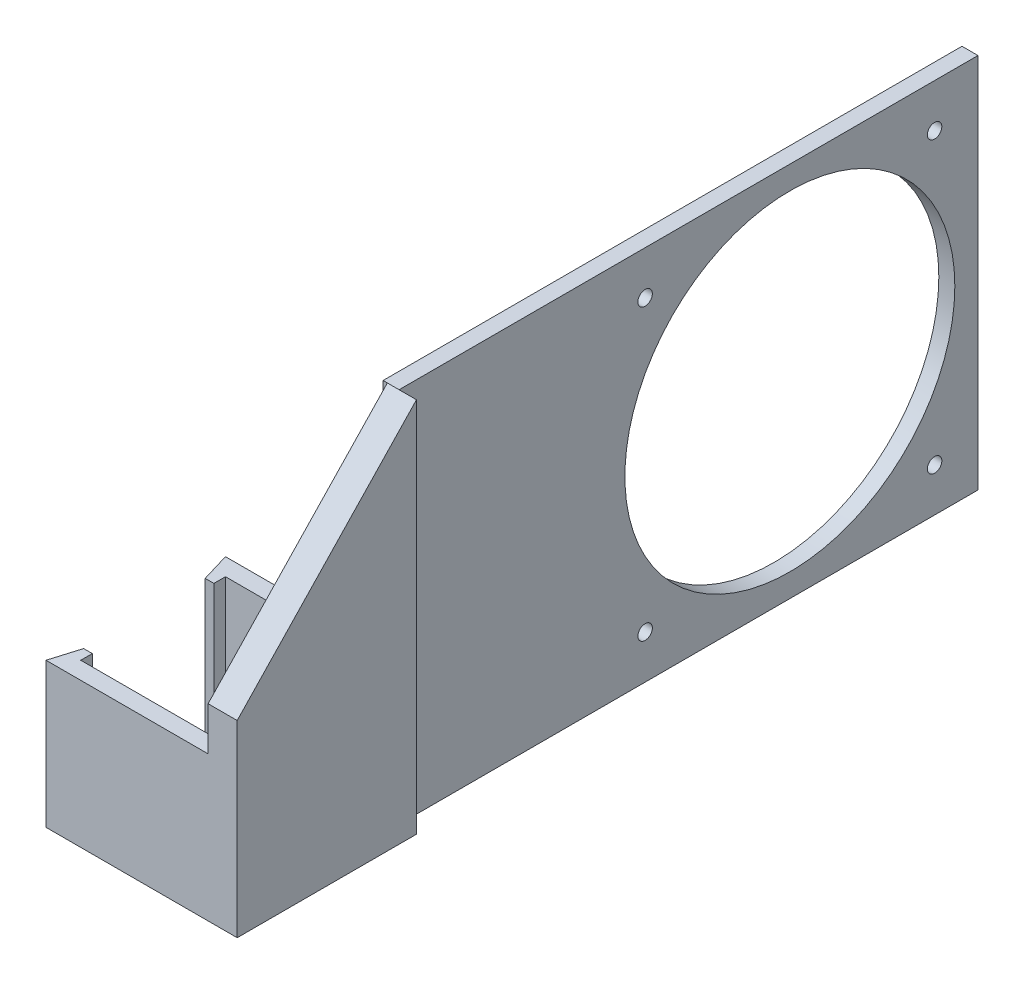
from build123d import *

# Parameters (mm, degrees)
EXTRUDE_1_DEPTH      = 25
CUT_EXTRUDE_4_DEPTH  = 80.457942189
SKETCH_7_W           = 16.60831278
SKETCH_7_H           = 38.473598513
CUT_EXTRUDE_14_DEPTH = 80.457942189
SKETCH_8_W           = 5
SKETCH_8_H           = 30.968526609
EXTRUDE_2_DEPTH      = 25
SKETCH_9_W           = 2.765387297
SKETCH_9_H           = 65
EXTRUDE_3_DEPTH      = 100
SKETCH_10_W          = 5.026813651
SKETCH_10_H          = 30.968526609
EXTRUDE_4_DEPTH      = 40
CUT_EXTRUDE_15_DEPTH = 100
SKETCH_12_R          = 28.5
CUT_EXTRUDE_16_DEPTH = 100
SKETCH_13_R          = 1.25
CUT_EXTRUDE_17_DEPTH = 100
CHAMFER_1_SIZE       = 10


with BuildPart() as part:
    # Эскиз1 → Бобышка-Вытянуть1 (new body)
    with BuildSketch(Plane(origin=(0, 0, 0), x_dir=(1, 0, 0), z_dir=(0, 1, 0))):
        Polygon((-66.825757576, 34.969739794), (-66.825757576, 29.969739794), (-63.825757576, 29.969739794), (-63.825757576, 31.969739794), (-38.825757576, 31.969739794), (-38.825757576, 6.969739794), (-63.825757576, 6.969739794), (-63.825757576, 8.969739794), (-66.825757576, 8.969739794), (-66.825757576, 3.969739794), (-22.123470102, 3.969739794), (-36.579007505, 34.969739794), align=None)
    extrude(amount=EXTRUDE_1_DEPTH)

    # Эскиз3 → Вырез-Вытянуть4 (cut, through all)
    with BuildSketch(Plane.XZ):
        Polygon((-66.825757576, -3.969739794), (-65.325757576, -8.969739794), (-66.825757576, -8.969739794), align=None)
        Polygon((-66.825757576, -29.969739794), (-66.825757576, -34.969739794), (-65.325757576, -29.969739794), align=None)
    extrude(amount=-CUT_EXTRUDE_4_DEPTH, mode=Mode.SUBTRACT)

    # Эскиз7 → Вырез-Вытянуть14 (cut, through all)
    with BuildSketch(Plane(origin=(0, 0, 0), x_dir=(-1, 0, 0), z_dir=(0, -1, 0))):
        with Locations((27.703474463, 20.539743139)):
            Rectangle(SKETCH_7_W, SKETCH_7_H)
    extrude(amount=-CUT_EXTRUDE_14_DEPTH, mode=Mode.SUBTRACT)

    # Эскиз8 → Бобышка-Вытянуть2 (add)
    with BuildSketch(Plane(origin=(0, 0, 0), x_dir=(-1, 0, 0), z_dir=(0, -1, 0))):
        with Locations((36.298943925, 19.454003098)):
            Rectangle(SKETCH_8_W, SKETCH_8_H)
    extrude(amount=-EXTRUDE_2_DEPTH)

    # Эскиз9 → Бобышка-Вытянуть3 (add)
    with BuildSketch(Plane(origin=(0, 0, -34.938266403), x_dir=(-1, 0, 0), z_dir=(0, 0, -1))):
        with Locations((38.181637573, 32.5)):
            Rectangle(SKETCH_9_W, SKETCH_9_H)
    extrude(amount=EXTRUDE_3_DEPTH)

    # Эскиз10 → Бобышка-Вытянуть4 (add)
    with BuildSketch(Plane(origin=(0, 25, 0), x_dir=(1, 0, 0), z_dir=(0, 1, 0))):
        with Locations((-36.312350751, 19.454003098)):
            Rectangle(SKETCH_10_W, SKETCH_10_H)
    extrude(amount=EXTRUDE_4_DEPTH)

    # Эскиз11 → Вырез-Вытянуть15 (cut)
    with BuildSketch(Plane(origin=(-33.798943925, 0, 0), x_dir=(0, 0, -1), z_dir=(1, 0, 0))):
        Polygon((34.938266403, 65), (3.969739794, 32.5), (3.969739794, 65), align=None)
    extrude(amount=-CUT_EXTRUDE_15_DEPTH, mode=Mode.SUBTRACT)

    # Эскиз12 → Вырез-Вытянуть16 (cut)
    with BuildSketch(Plane(origin=(-36.798943925, 0, 0), x_dir=(0, 0, -1), z_dir=(1, 0, 0))):
        with Locations((102.438266403, 32.5)):
            Circle(SKETCH_12_R)
    extrude(amount=-CUT_EXTRUDE_16_DEPTH, mode=Mode.SUBTRACT)

    # Эскиз13 → Вырез-Вытянуть17 (cut)
    with BuildSketch(Plane(origin=(-36.798943925, 0, 0), x_dir=(0, 0, -1), z_dir=(1, 0, 0))):
        with Locations((77.438266403, 57.5)):
            Circle(SKETCH_13_R)
        with Locations((127.438266403, 57.5)):
            Circle(SKETCH_13_R)
        with Locations((127.438266403, 7.5)):
            Circle(SKETCH_13_R)
        with Locations((77.438266403, 7.5)):
            Circle(SKETCH_13_R)
    extrude(amount=-CUT_EXTRUDE_17_DEPTH, mode=Mode.SUBTRACT)

    # Фаска1
    chamfer_1_edges = [part.edges().sort_by_distance(p)[0] for p in [
        (-39.564331222, 12.5, -34.969739794),
    ]]
    chamfer(chamfer_1_edges, length=CHAMFER_1_SIZE)


solid = part.part
